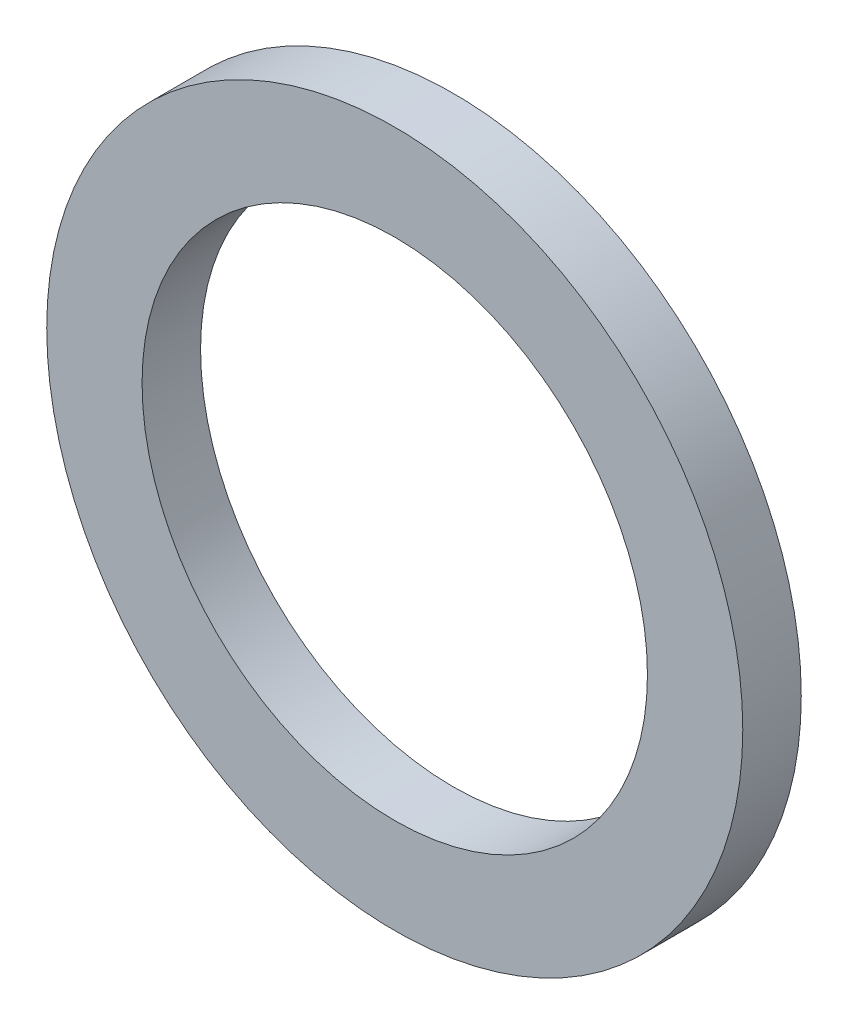
from build123d import *

# Parameters (mm, degrees)
IZIM1_R                     = 11.9
IZIM1_R_2                   = 8.64
Y_KSEKLIK_EKSTR_ZYON1_DEPTH = 2


with BuildPart() as part:
    # Çizim1 → Yükseklik-Ekstrüzyon1 (new body)
    with BuildSketch(Plane.XY):
        Circle(IZIM1_R)
        Circle(IZIM1_R_2, mode=Mode.SUBTRACT)
    extrude(amount=Y_KSEKLIK_EKSTR_ZYON1_DEPTH)


solid = part.part
